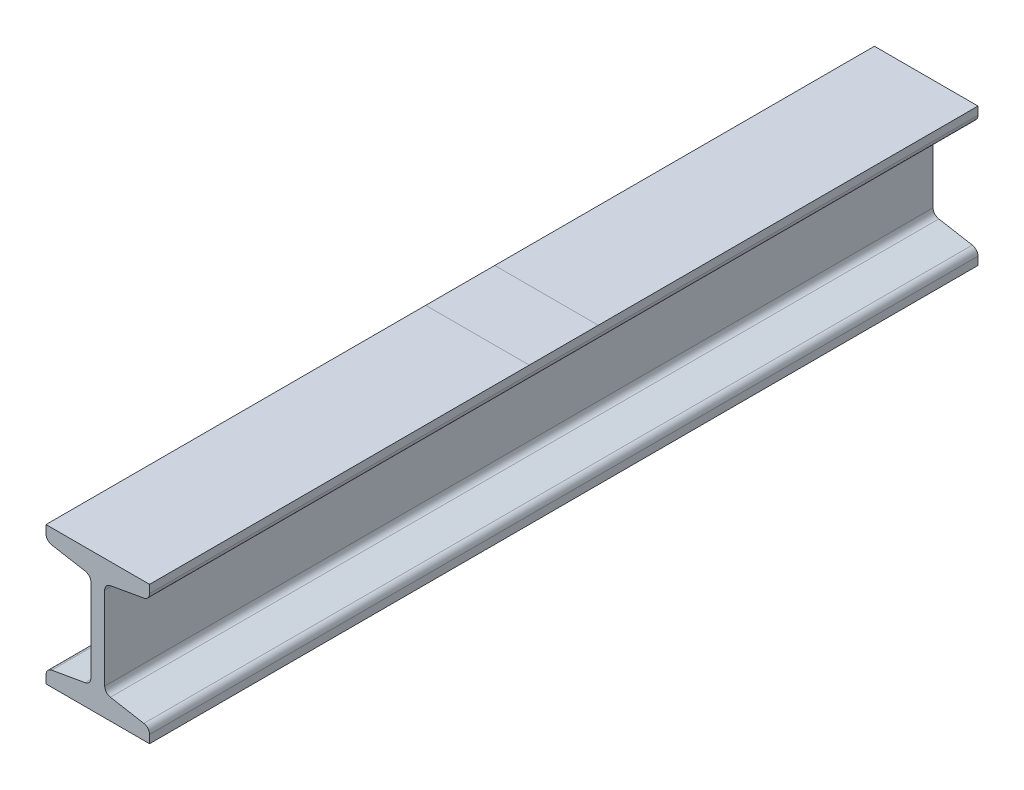
from build123d import *

# Parameters (mm, degrees)
BOSS_EXTRUDE1_DEPTH = 600
FILLET1_R           = 5


with BuildPart() as part:
    # Sketch1 → Boss-Extrude1 (new body)
    with BuildSketch(Plane.XY):
        Polygon((-37.5, 50), (37.5, 50), (37.5, 40), (5, 34.269373127), (5, -34.269373127), (37.5, -40), (37.5, -50), (-37.5, -50), (-37.5, -40), (-5, -34.269373127), (-5, 34.269373127), (-37.5, 40), align=None)
    extrude(amount=BOSS_EXTRUDE1_DEPTH)

    # Fillet1
    fillet1_edges = [part.edges().sort_by_distance(p)[0] for p in [
        (5, 34.269373127, 300),
        (5, -34.269373127, 300),
        (37.5, -40, 300),
        (-37.5, -40, 300),
        (-5, -34.269373127, 300),
        (-5, 34.269373127, 300),
        (-37.5, 40, 300),
        (37.5, 40, 300),
    ]]
    fillet(fillet1_edges, radius=FILLET1_R)


solid = part.part
